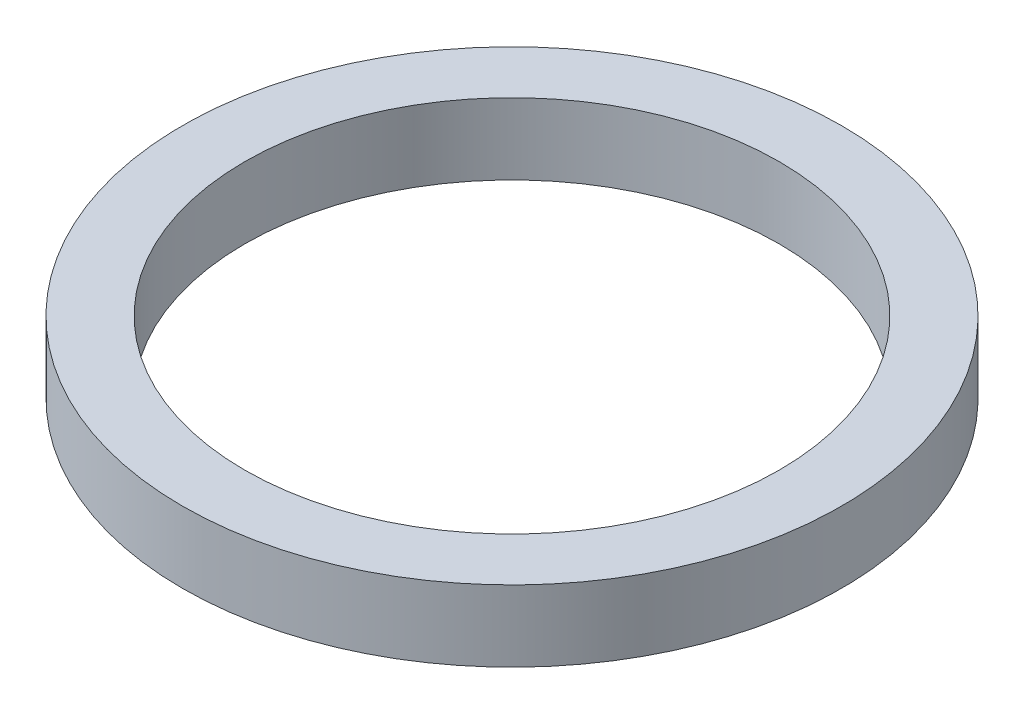
from build123d import *

# Parameters (mm, degrees)
SKETCH1_R           = 18.5
SKETCH1_R_2         = 15
BOSS_EXTRUDE1_DEPTH = 2


with BuildPart() as part:
    # Sketch1 → Boss-Extrude1 (new, symmetric)
    with BuildSketch(Plane(origin=(0, 0, 0), x_dir=(1, 0, 0), z_dir=(0, 1, 0))):
        with Locations(Location((0, 0, 0), (0, 0, 270))):
            Circle(SKETCH1_R)
        with Locations(Location((0, 0, 0), (0, 0, 270))):
            Circle(SKETCH1_R_2, mode=Mode.SUBTRACT)
    extrude(amount=BOSS_EXTRUDE1_DEPTH, both=True)


solid = part.part
